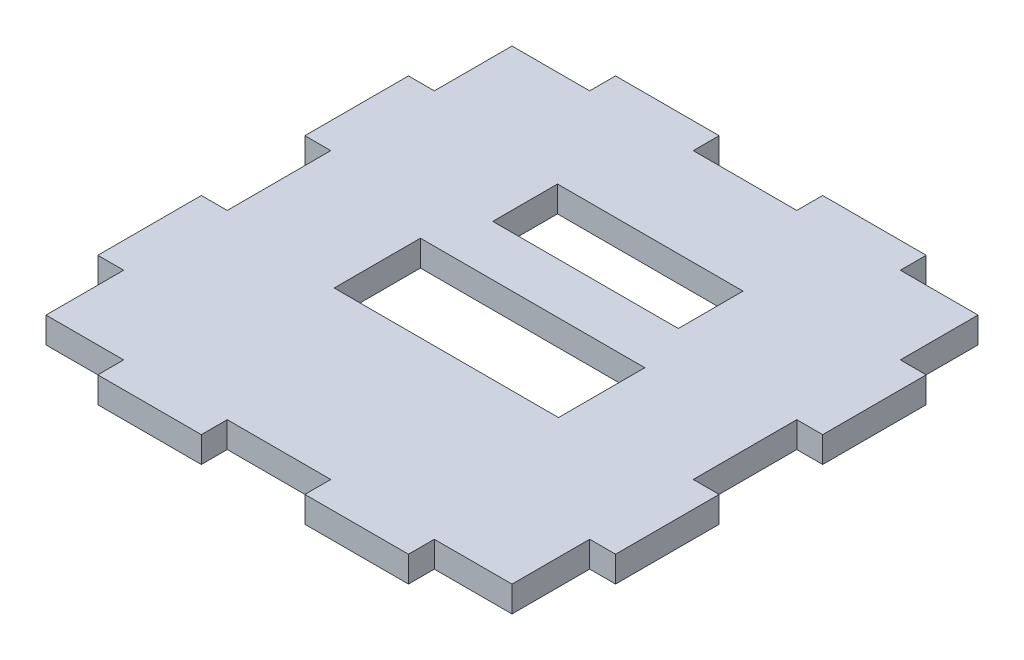
from build123d import *

# Parameters (mm, degrees)
SKETCH1_W           = 190.5
SKETCH1_H           = 190.5
BOSS_EXTRUDE1_DEPTH = 9.525
SKETCH2_W           = 9.525
SKETCH2_H           = 38.1
CUT_EXTRUDE1_DEPTH  = 9.525
SKETCH3_W           = 9.525
SKETCH3_H           = 38.1
CUT_EXTRUDE2_DEPTH  = 9.525
SKETCH4_W           = 9.525
SKETCH4_H           = 38.1
CUT_EXTRUDE3_DEPTH  = 9.525
SKETCH5_W           = 9.525
SKETCH5_H           = 38.1
CUT_EXTRUDE4_DEPTH  = 9.525
SKETCH6_W           = 9.525
SKETCH6_H           = 38.1
CUT_EXTRUDE5_DEPTH  = 9.525
SKETCH7_W           = 9.525
SKETCH7_H           = 38.1
CUT_EXTRUDE6_DEPTH  = 9.525
SKETCH8_W           = 28.575
SKETCH8_H           = 9.525
CUT_EXTRUDE7_DEPTH  = 9.525
SKETCH9_W           = 38.1
SKETCH9_H           = 9.525
CUT_EXTRUDE8_DEPTH  = 9.525
SKETCH10_W          = 28.575
SKETCH10_H          = 9.525
CUT_EXTRUDE9_DEPTH  = 9.525
SKETCH11_W          = 28.575
SKETCH11_H          = 9.525
CUT_EXTRUDE11_DEPTH = 9.525
SKETCH12_W          = 38.1
SKETCH12_H          = 9.525
CUT_EXTRUDE12_DEPTH = 9.525
SKETCH14_W          = 28.575
SKETCH14_H          = 9.525
CUT_EXTRUDE13_DEPTH = 9.525
SKETCH15_W          = 68.2625
SKETCH15_H          = 23.8125
CUT_EXTRUDE14_DEPTH = 9.525
SKETCH16_W          = 82.55
SKETCH16_H          = 31.75
CUT_EXTRUDE15_DEPTH = 9.525


with BuildPart() as part:
    # Sketch1 → Boss-Extrude1 (new body)
    with BuildSketch(Plane(origin=(0, 0, 0), x_dir=(1, 0, 0), z_dir=(0, 1, 0))):
        with Locations((-91.022160665, 92.07132964)):
            Rectangle(SKETCH1_W, SKETCH1_H)
    extrude(amount=BOSS_EXTRUDE1_DEPTH)

    # Sketch2 → Cut-Extrude1 (cut)
    with BuildSketch(Plane(origin=(0, 9.525, 0), x_dir=(1, 0, 0), z_dir=(0, 1, 0))):
        with Locations((-0.534660665, 15.87132964)):
            Rectangle(SKETCH2_W, SKETCH2_H)
    extrude(amount=-CUT_EXTRUDE1_DEPTH, mode=Mode.SUBTRACT)

    # Sketch3 → Cut-Extrude2 (cut)
    with BuildSketch(Plane(origin=(0, 9.525, 0), x_dir=(1, 0, 0), z_dir=(0, 1, 0))):
        with Locations((-0.534660665, 92.07132964)):
            Rectangle(SKETCH3_W, SKETCH3_H)
    extrude(amount=-CUT_EXTRUDE2_DEPTH, mode=Mode.SUBTRACT)

    # Sketch4 → Cut-Extrude3 (cut)
    with BuildSketch(Plane(origin=(0, 9.525, 0), x_dir=(1, 0, 0), z_dir=(0, 1, 0))):
        with Locations((-0.534660665, 168.27132964)):
            Rectangle(SKETCH4_W, SKETCH4_H)
    extrude(amount=-CUT_EXTRUDE3_DEPTH, mode=Mode.SUBTRACT)

    # Sketch5 → Cut-Extrude4 (cut)
    with BuildSketch(Plane.XZ):
        with Locations((-181.509660665, -15.87132964)):
            Rectangle(SKETCH5_W, SKETCH5_H)
    extrude(amount=-CUT_EXTRUDE4_DEPTH, mode=Mode.SUBTRACT)

    # Sketch6 → Cut-Extrude5 (cut)
    with BuildSketch(Plane.XZ):
        with Locations((-181.509660665, -92.07132964)):
            Rectangle(SKETCH6_W, SKETCH6_H)
    extrude(amount=-CUT_EXTRUDE5_DEPTH, mode=Mode.SUBTRACT)

    # Sketch7 → Cut-Extrude6 (cut)
    with BuildSketch(Plane.XZ):
        with Locations((-181.509660665, -168.27132964)):
            Rectangle(SKETCH7_W, SKETCH7_H)
    extrude(amount=-CUT_EXTRUDE6_DEPTH, mode=Mode.SUBTRACT)

    # Sketch8 → Cut-Extrude7 (cut)
    with BuildSketch(Plane.XZ):
        with Locations((-19.584660665, -182.55882964)):
            Rectangle(SKETCH8_W, SKETCH8_H)
    extrude(amount=-CUT_EXTRUDE7_DEPTH, mode=Mode.SUBTRACT)

    # Sketch9 → Cut-Extrude8 (cut)
    with BuildSketch(Plane.XZ):
        with Locations((-91.022160665, -182.55882964)):
            Rectangle(SKETCH9_W, SKETCH9_H)
    extrude(amount=-CUT_EXTRUDE8_DEPTH, mode=Mode.SUBTRACT)

    # Sketch10 → Cut-Extrude9 (cut)
    with BuildSketch(Plane.XZ):
        with Locations((-162.459660665, -182.55882964)):
            Rectangle(SKETCH10_W, SKETCH10_H)
    extrude(amount=-CUT_EXTRUDE9_DEPTH, mode=Mode.SUBTRACT)

    # Sketch11 → Cut-Extrude11 (cut)
    with BuildSketch(Plane(origin=(0, 0, 0), x_dir=(-1, 0, 0), z_dir=(0, -1, 0))):
        with Locations((162.459660665, 1.58382964)):
            Rectangle(SKETCH11_W, SKETCH11_H)
    extrude(amount=-CUT_EXTRUDE11_DEPTH, mode=Mode.SUBTRACT)

    # Sketch12 → Cut-Extrude12 (cut)
    with BuildSketch(Plane.XZ):
        with Locations((-91.022160665, -1.58382964)):
            Rectangle(SKETCH12_W, SKETCH12_H)
    extrude(amount=-CUT_EXTRUDE12_DEPTH, mode=Mode.SUBTRACT)

    # Sketch14 → Cut-Extrude13 (cut)
    with BuildSketch(Plane(origin=(0, 0, 0), x_dir=(-1, 0, 0), z_dir=(0, -1, 0))):
        with Locations((19.584660665, 1.58382964)):
            Rectangle(SKETCH14_W, SKETCH14_H)
    extrude(amount=-CUT_EXTRUDE13_DEPTH, mode=Mode.SUBTRACT)

    # Sketch15 → Cut-Extrude14 (cut)
    with BuildSketch(Plane.XZ):
        with Locations((-90.276924716, -130.287204322)):
            Rectangle(SKETCH15_W, SKETCH15_H)
    extrude(amount=-CUT_EXTRUDE14_DEPTH, mode=Mode.SUBTRACT)

    # Sketch16 → Cut-Extrude15 (cut)
    with BuildSketch(Plane.XZ):
        with Locations((-91.083368355, -83.846953715)):
            Rectangle(SKETCH16_W, SKETCH16_H)
    extrude(amount=-CUT_EXTRUDE15_DEPTH, mode=Mode.SUBTRACT)


solid = part.part
